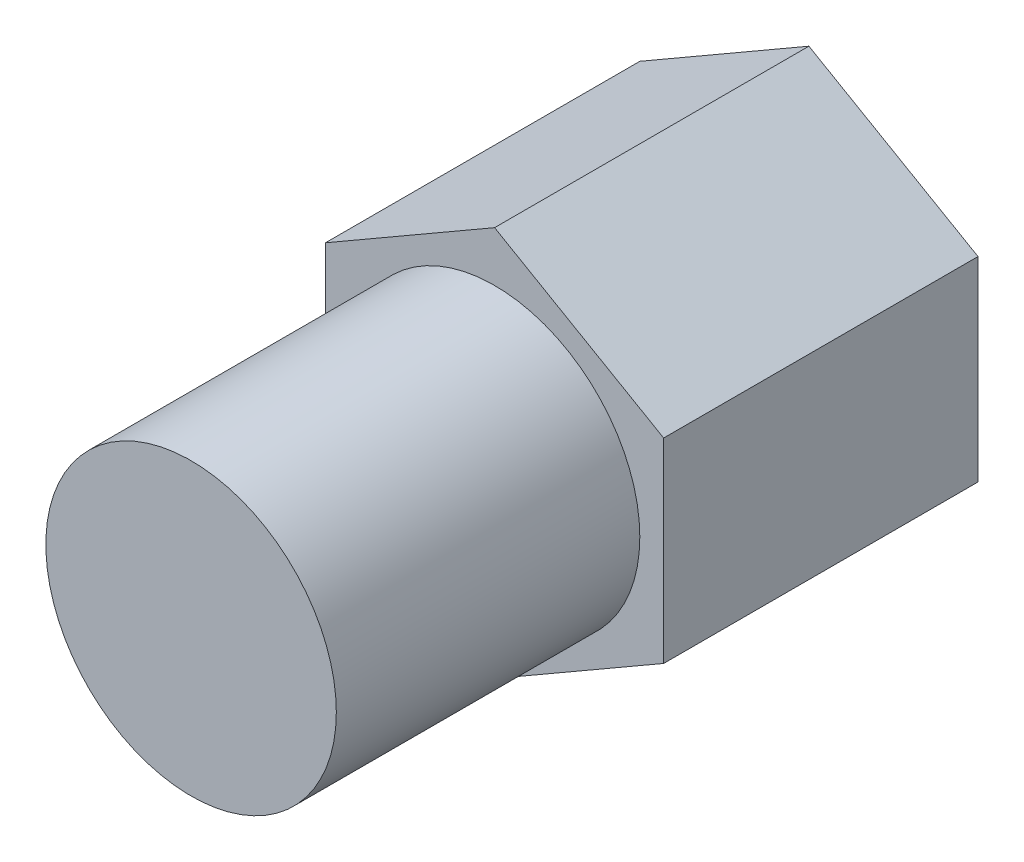
from build123d import *

# Parameters (mm, degrees)
BOSS_EXTRUDE1_DEPTH = 14.5
SKETCH2_R           = 6.7
BOSS_EXTRUDE2_DEPTH = 14


with BuildPart() as part:
    # Sketch1 → Boss-Extrude1 (new body)
    with BuildSketch(Plane(origin=(0, 0, 0), x_dir=(0, 1, 0), z_dir=(0, 0, 1))):
        Polygon((9.006664199, 0), (4.5033321, 7.8), (-4.5033321, 7.8), (-9.006664199, 0), (-4.5033321, -7.8), (4.5033321, -7.8), align=None)
    extrude(amount=BOSS_EXTRUDE1_DEPTH)

    # Sketch2 → Boss-Extrude2 (add)
    with BuildSketch(Plane.XY.offset(14.5)):
        Circle(SKETCH2_R)
    extrude(amount=BOSS_EXTRUDE2_DEPTH)


solid = part.part
